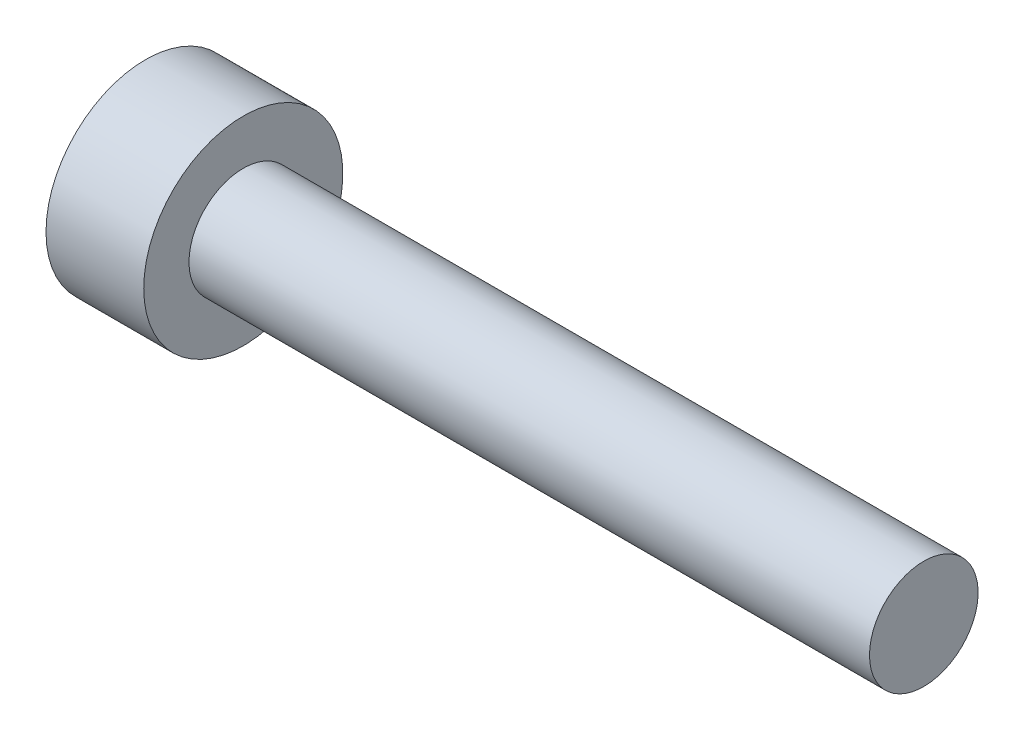
from build123d import *


with BuildPart() as part:
    # Axial profile (mm) → Full revolution (revolve)
    with BuildSketch(Plane.XY, mode=Mode.PRIVATE) as full_revolution_sk:
        Polygon((146, 0), (167.5, 0), (167.5, 1.5), (148.7, 1.5), (148.7, 2.75), (146, 2.75), align=None)
    revolve(full_revolution_sk.sketch.rotate(Axis((-110, 0, 0), (1, 0, 0)), 90), axis=Axis((-110, 0, 0), (1, 0, 0)))


solid = part.part
